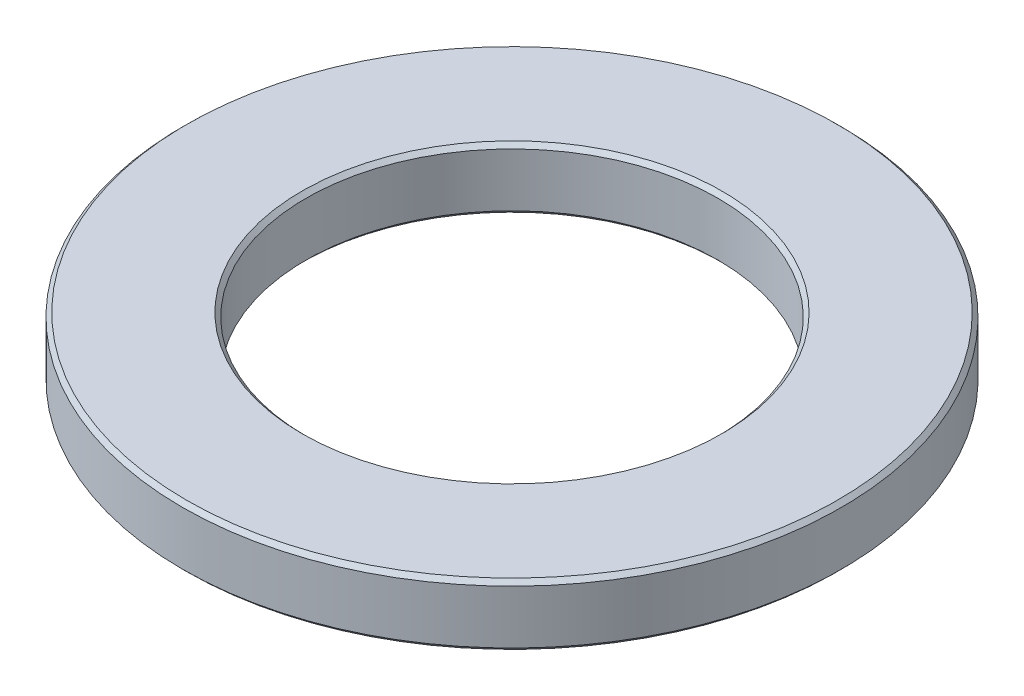
from build123d import *

# Parameters (mm, degrees)
PROFILES_R    = 8
PROFILES_R_2  = 5
PROFILE_DEPTH = 1.5
OUTERC_SIZE   = 0.1
INNERC_SIZE   = 0.1


with BuildPart() as part:
    # ProfileS → Profile (new body)
    with BuildSketch(Plane(origin=(0, 0, 0), x_dir=(1, 0, 0), z_dir=(0, 1, 0))):
        with Locations(Location((0, 0, 0), (0, 0, 270))):
            Circle(PROFILES_R)
        with Locations(Location((0, 0, 0), (0, 0, 270))):
            Circle(PROFILES_R_2, mode=Mode.SUBTRACT)
    extrude(amount=PROFILE_DEPTH)

    # OuterC
    outerc_edges = [part.edges().sort_by_distance(p)[0] for p in [
        (0, 0, -8),
        (0, 1.5, -8),
    ]]
    chamfer(outerc_edges, length=OUTERC_SIZE)

    # InnerC
    innerc_edges = [part.edges().sort_by_distance(p)[0] for p in [
        (0, 0, -5),
        (0, 1.5, -5),
    ]]
    chamfer(innerc_edges, length=INNERC_SIZE)


solid = part.part
